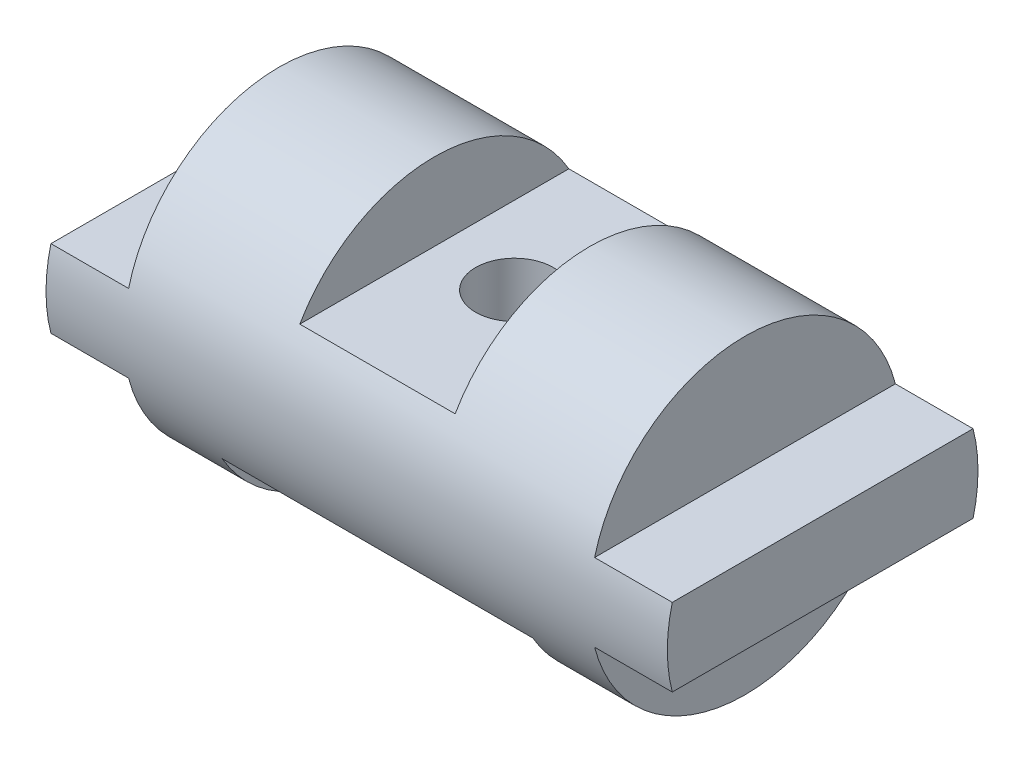
from build123d import *

# Parameters (mm, degrees)
SKETCH1_R                           = 20
BOSS_EXTRUDE1_DEPTH                 = 80
CUT_EXTRUDE1_REACH                  = 86.853
CUT_EXTRUDE1_END_RADIUS             = 20
SKETCH2_W                           = 20
SKETCH2_H                           = 10
SKETCH2_W_2                         = 10
SKETCH2_H_2                         = 15
SKETCH2_W_3                         = 40
CUT_EXTRUDE1_DIRECTION_2_REACH      = 86.853
CUT_EXTRUDE1_DIRECTION_2_END_RADIUS = 20
CUT_EXTRUDE2_REACH                  = 89.75
SKETCH3_R                           = 5


with BuildPart() as part:
    # Sketch1 → Boss-Extrude1 (new body)
    with BuildSketch(Plane(origin=(0, 0, 0), x_dir=(0, 0, -1), z_dir=(1, 0, 0))):
        Circle(SKETCH1_R)
    extrude(amount=BOSS_EXTRUDE1_DEPTH)

    # Cut-Extrude1: up to this cylinder (the profile starts inside it)
    cut_extrude1_end = Plane(origin=(40, 0, 0), z_dir=(-1, 0, 0)) * Cylinder(CUT_EXTRUDE1_END_RADIUS, 284.706, mode=Mode.PRIVATE)
    # Sketch2 → Cut-Extrude1 (cut, up to the surface)
    with BuildSketch(Plane.XY, mode=Mode.PRIVATE) as cut_extrude1_sk1:
        with Locations((40, 15)):
            Rectangle(SKETCH2_W, SKETCH2_H)
    cut_extrude1_tool1 = extrude(cut_extrude1_sk1.sketch, amount=-CUT_EXTRUDE1_REACH, mode=Mode.PRIVATE) & cut_extrude1_end
    add(cut_extrude1_tool1.solids().sort_by_distance((40, 15, 0))[0], mode=Mode.SUBTRACT)
    # Sketch2 → Cut-Extrude1 (cut, up to the surface)
    with BuildSketch(Plane.XY, mode=Mode.PRIVATE) as cut_extrude1_sk2:
        with Locations((5, 12.5)):
            Rectangle(SKETCH2_W_2, SKETCH2_H_2)
    cut_extrude1_tool2 = extrude(cut_extrude1_sk2.sketch, amount=-CUT_EXTRUDE1_REACH, mode=Mode.PRIVATE) & cut_extrude1_end
    add(cut_extrude1_tool2.solids().sort_by_distance((5, 12.5, 0))[0], mode=Mode.SUBTRACT)
    # Sketch2 → Cut-Extrude1 (cut, up to the surface)
    with BuildSketch(Plane.XY, mode=Mode.PRIVATE) as cut_extrude1_sk3:
        with Locations((5, -12.5)):
            Rectangle(SKETCH2_W_2, SKETCH2_H_2)
    cut_extrude1_tool3 = extrude(cut_extrude1_sk3.sketch, amount=-CUT_EXTRUDE1_REACH, mode=Mode.PRIVATE) & cut_extrude1_end
    add(cut_extrude1_tool3.solids().sort_by_distance((5, -12.5, 0))[0], mode=Mode.SUBTRACT)
    # Sketch2 → Cut-Extrude1 (cut, up to the surface)
    with BuildSketch(Plane.XY, mode=Mode.PRIVATE) as cut_extrude1_sk4:
        with Locations((75, 12.5)):
            Rectangle(SKETCH2_W_2, SKETCH2_H_2)
    cut_extrude1_tool4 = extrude(cut_extrude1_sk4.sketch, amount=-CUT_EXTRUDE1_REACH, mode=Mode.PRIVATE) & cut_extrude1_end
    add(cut_extrude1_tool4.solids().sort_by_distance((75, 12.5, 0))[0], mode=Mode.SUBTRACT)
    # Sketch2 → Cut-Extrude1 (cut, up to the surface)
    with BuildSketch(Plane.XY, mode=Mode.PRIVATE) as cut_extrude1_sk5:
        with Locations((75, -12.5)):
            Rectangle(SKETCH2_W_2, SKETCH2_H_2)
    cut_extrude1_tool5 = extrude(cut_extrude1_sk5.sketch, amount=-CUT_EXTRUDE1_REACH, mode=Mode.PRIVATE) & cut_extrude1_end
    add(cut_extrude1_tool5.solids().sort_by_distance((75, -12.5, 0))[0], mode=Mode.SUBTRACT)
    # Sketch2 → Cut-Extrude1 (cut, up to the surface)
    with BuildSketch(Plane.XY, mode=Mode.PRIVATE) as cut_extrude1_sk6:
        with Locations((40, -15)):
            Rectangle(SKETCH2_W_3, SKETCH2_H)
    cut_extrude1_tool6 = extrude(cut_extrude1_sk6.sketch, amount=-CUT_EXTRUDE1_REACH, mode=Mode.PRIVATE) & cut_extrude1_end
    add(cut_extrude1_tool6.solids().sort_by_distance((40, -15, 0))[0], mode=Mode.SUBTRACT)

    # Cut-Extrude1 direction 2: up to this cylinder (the profile starts inside it)
    cut_extrude1_direction_2_end = Plane(origin=(40, 0, 0), z_dir=(-1, 0, 0)) * Cylinder(CUT_EXTRUDE1_DIRECTION_2_END_RADIUS, 284.706, mode=Mode.PRIVATE)
    # Sketch2 → Cut-Extrude1 direction 2 (cut, up to the surface)
    with BuildSketch(Plane.XY, mode=Mode.PRIVATE) as cut_extrude1_direction_2_sk1:
        with Locations((40, 15)):
            Rectangle(SKETCH2_W, SKETCH2_H)
    cut_extrude1_direction_2_tool1 = extrude(cut_extrude1_direction_2_sk1.sketch, amount=CUT_EXTRUDE1_DIRECTION_2_REACH, mode=Mode.PRIVATE) & cut_extrude1_direction_2_end
    add(cut_extrude1_direction_2_tool1.solids().sort_by_distance((40, 15, 0))[0], mode=Mode.SUBTRACT)
    # Sketch2 → Cut-Extrude1 direction 2 (cut, up to the surface)
    with BuildSketch(Plane.XY, mode=Mode.PRIVATE) as cut_extrude1_direction_2_sk2:
        with Locations((5, 12.5)):
            Rectangle(SKETCH2_W_2, SKETCH2_H_2)
    cut_extrude1_direction_2_tool2 = extrude(cut_extrude1_direction_2_sk2.sketch, amount=CUT_EXTRUDE1_DIRECTION_2_REACH, mode=Mode.PRIVATE) & cut_extrude1_direction_2_end
    add(cut_extrude1_direction_2_tool2.solids().sort_by_distance((5, 12.5, 0))[0], mode=Mode.SUBTRACT)
    # Sketch2 → Cut-Extrude1 direction 2 (cut, up to the surface)
    with BuildSketch(Plane.XY, mode=Mode.PRIVATE) as cut_extrude1_direction_2_sk3:
        with Locations((5, -12.5)):
            Rectangle(SKETCH2_W_2, SKETCH2_H_2)
    cut_extrude1_direction_2_tool3 = extrude(cut_extrude1_direction_2_sk3.sketch, amount=CUT_EXTRUDE1_DIRECTION_2_REACH, mode=Mode.PRIVATE) & cut_extrude1_direction_2_end
    add(cut_extrude1_direction_2_tool3.solids().sort_by_distance((5, -12.5, 0))[0], mode=Mode.SUBTRACT)
    # Sketch2 → Cut-Extrude1 direction 2 (cut, up to the surface)
    with BuildSketch(Plane.XY, mode=Mode.PRIVATE) as cut_extrude1_direction_2_sk4:
        with Locations((75, 12.5)):
            Rectangle(SKETCH2_W_2, SKETCH2_H_2)
    cut_extrude1_direction_2_tool4 = extrude(cut_extrude1_direction_2_sk4.sketch, amount=CUT_EXTRUDE1_DIRECTION_2_REACH, mode=Mode.PRIVATE) & cut_extrude1_direction_2_end
    add(cut_extrude1_direction_2_tool4.solids().sort_by_distance((75, 12.5, 0))[0], mode=Mode.SUBTRACT)
    # Sketch2 → Cut-Extrude1 direction 2 (cut, up to the surface)
    with BuildSketch(Plane.XY, mode=Mode.PRIVATE) as cut_extrude1_direction_2_sk5:
        with Locations((75, -12.5)):
            Rectangle(SKETCH2_W_2, SKETCH2_H_2)
    cut_extrude1_direction_2_tool5 = extrude(cut_extrude1_direction_2_sk5.sketch, amount=CUT_EXTRUDE1_DIRECTION_2_REACH, mode=Mode.PRIVATE) & cut_extrude1_direction_2_end
    add(cut_extrude1_direction_2_tool5.solids().sort_by_distance((75, -12.5, 0))[0], mode=Mode.SUBTRACT)
    # Sketch2 → Cut-Extrude1 direction 2 (cut, up to the surface)
    with BuildSketch(Plane.XY, mode=Mode.PRIVATE) as cut_extrude1_direction_2_sk6:
        with Locations((40, -15)):
            Rectangle(SKETCH2_W_3, SKETCH2_H)
    cut_extrude1_direction_2_tool6 = extrude(cut_extrude1_direction_2_sk6.sketch, amount=CUT_EXTRUDE1_DIRECTION_2_REACH, mode=Mode.PRIVATE) & cut_extrude1_direction_2_end
    add(cut_extrude1_direction_2_tool6.solids().sort_by_distance((40, -15, 0))[0], mode=Mode.SUBTRACT)

    # Sketch3 → Cut-Extrude2 (cut, up to next)
    with BuildSketch(Plane(origin=(0, 10, 0), x_dir=(1, 0, 0), z_dir=(0, 1, 0)), mode=Mode.PRIVATE) as cut_extrude2_sk1:
        with Locations(Location((40, 0.320508076, 0), (0, 0, 180))):
            Circle(SKETCH3_R)
    cut_extrude2_tool1 = extrude(cut_extrude2_sk1.sketch, amount=-CUT_EXTRUDE2_REACH, mode=Mode.PRIVATE) & part.part
    add(cut_extrude2_tool1.solids().sort_by_distance((40, 10, -0.320508))[0], mode=Mode.SUBTRACT)


solid = part.part
